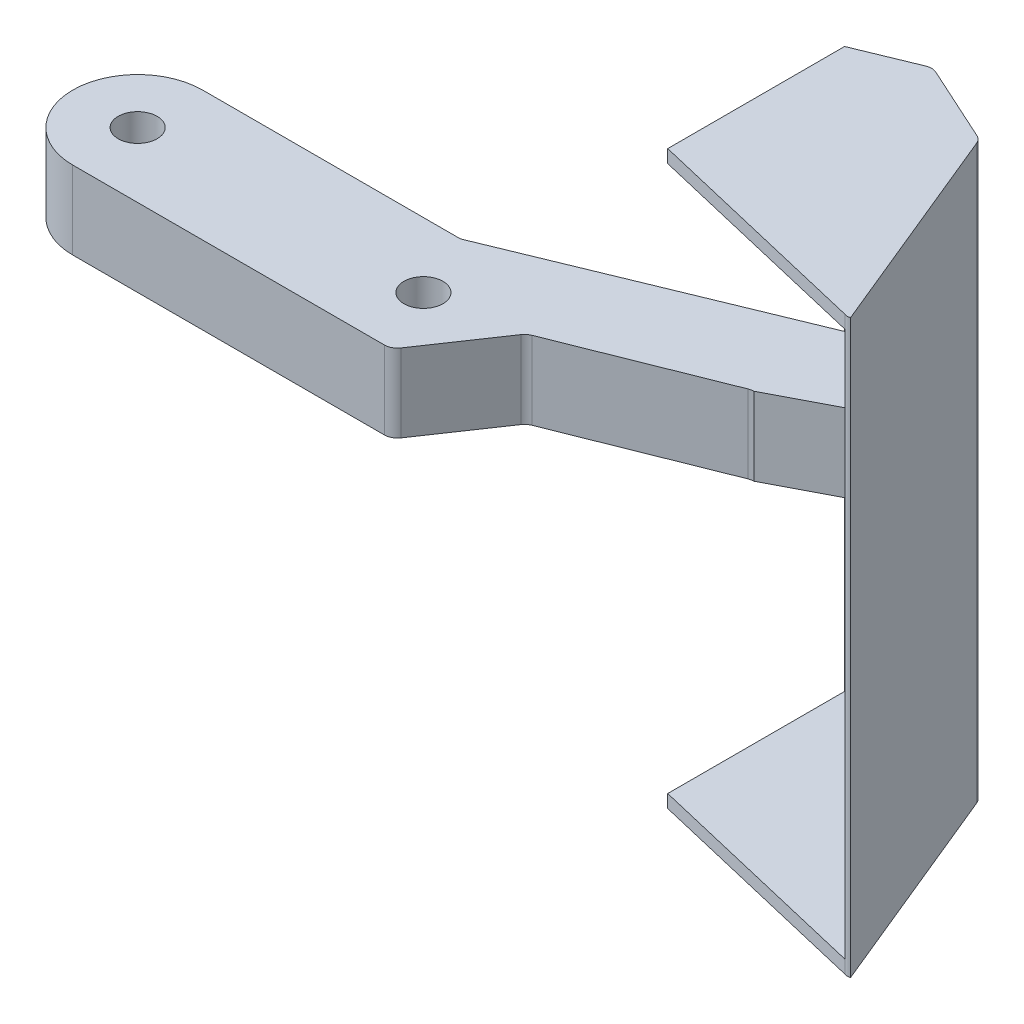
from build123d import *

# Parameters (mm, degrees)
SKETCH1_R                    = 1.5
BOSS_EXTRUDE1_DEPTH          = 6
SALIENTE_EXTRUIR7_DEPTH      = 19
SALIENTE_EXTRUIR7_DEPTH_BACK = 25
CORTAR_EXTRUIR2_DEPTH        = 25
SALIENTE_EXTRUIR8_DEPTH      = 1
SALIENTE_EXTRUIR10_DEPTH     = 1


with BuildPart() as part:
    # Sketch1 → Boss-Extrude1 (new body)
    with BuildSketch(Plane(origin=(0, 0, 0), x_dir=(1, 0, 0), z_dir=(0, 1, 0))):
        with BuildLine():
            Line((0, -5), (23.998875872, -5))
            ThreePointArc((23.998875872, -5), (24.467345461, -4.883479623), (24.826642543, -4.561072489))
            Line((24.826642543, -4.561072489), (28.564941326, 0.954149161))
            ThreePointArc((28.564941326, 0.954149161), (28.766036178, 1.172359953), (29.022312673, 1.321950886))
            Line((29.022312673, 1.321950886), (40.929553216, 6.070049343))
            ThreePointArc((40.929553216, 6.070049343), (41.304486381, 6.141164834), (41.678758689, 6.066649533))
            Line((41.678758689, 6.066649533), (47.144586244, 3.829406729))
            Line((47.144586244, 3.829406729), (48.06174016, 3.086958957))
            Line((48.06174016, 3.086958957), (48.804187932, 4.004112872))
            Line((48.804187932, 4.004112872), (49.721341848, 3.2616651))
            Line((49.721341848, 3.2616651), (50.46378962, 4.178819016))
            Line((50.46378962, 4.178819016), (51.380943536, 3.436371244))
            Line((51.380943536, 3.436371244), (52.123391308, 4.35352516))
            Line((52.123391308, 4.35352516), (53.040545224, 3.611077387))
            Line((53.040545224, 3.611077387), (53.782992996, 4.528231303))
            Line((53.782992996, 4.528231303), (54.700146912, 3.785783531))
            Line((54.700146912, 3.785783531), (55.442594685, 4.702937447))
            Line((55.442594685, 4.702937447), (52.341745918, 12.244834503))
            ThreePointArc((52.341745918, 12.244834503), (52.137055639, 12.558350103), (51.831402108, 12.774604725))
            Line((51.831402108, 12.774604725), (46.024183924, 15.419882568))
            ThreePointArc((46.024183924, 15.419882568), (45.628323444, 15.509674561), (45.229386093, 15.434727162))
            Line((45.229386093, 15.434727162), (20.032711481, 5.075121772))
            ThreePointArc((20.032711481, 5.075121772), (19.846254378, 5.018960187), (19.652448068, 5))
            Line((19.652448068, 5), (0, 5))
            ThreePointArc((0, 5), (-5, 0), (0, -5))
        make_face()
        with Locations(Location((0, 0, 0), (0, 0, 270))):
            Circle(SKETCH1_R, mode=Mode.SUBTRACT)
        with Locations(Location((22, 0, 0), (0, 0, 270))):
            Circle(SKETCH1_R, mode=Mode.SUBTRACT)
    extrude(amount=BOSS_EXTRUDE1_DEPTH)

    # Croquis4 → Saliente-Extruir7 (add, two sides: drawn at the far end of the back side and taken through both)
    with BuildSketch(Plane.XZ.offset(-SALIENTE_EXTRUIR7_DEPTH_BACK)):
        with BuildLine():
            Line((54.700146912, -3.785783531), (55.442594685, -4.702937447))
            Line((55.442594685, -4.702937447), (58.800233779, 3.463526096))
            Line((58.800233779, 3.463526096), (59.114761869, 4.228522601))
            ThreePointArc((59.114761869, 4.228522601), (58.907872463, 4.269394003), (58.700983057, 4.228522601))
            Line((58.700983057, 4.228522601), (53.767339251, -4.508894058))
            Line((53.767339251, -4.508894058), (53.782992996, -4.528231303))
            Line((53.782992996, -4.528231303), (54.700146912, -3.785783531))
        make_face()
        with BuildLine():
            Line((54.16164527, -7.818467854), (54.301219391, -7.478995106))
            Line((54.301219391, -7.478995106), (55.442594685, -4.702937447))
            Line((55.442594685, -4.702937447), (54.700146912, -3.785783531))
            Line((54.700146912, -3.785783531), (53.782992996, -4.528231303))
            Line((53.782992996, -4.528231303), (53.767339251, -4.508894058))
            Line((53.767339251, -4.508894058), (50.221708115, -10.788158993))
            Line((50.221708115, -10.788158993), (40.806466815, -13.616245196))
            Line((40.806466815, -13.616245196), (45.229386093, -15.434727162))
            ThreePointArc((45.229386093, -15.434727162), (45.628323444, -15.509674561), (46.024183924, -15.419882568))
            Line((46.024183924, -15.419882568), (51.831402108, -12.774604725))
            ThreePointArc((51.831402108, -12.774604725), (52.137055639, -12.558350103), (52.341745918, -12.244834503))
            Line((52.341745918, -12.244834503), (54.16164527, -7.818467854))
        make_face()
    extrude(amount=SALIENTE_EXTRUIR7_DEPTH + SALIENTE_EXTRUIR7_DEPTH_BACK)

    # Croquis5 → Cortar-Extruir2 (cut)
    with BuildSketch(Plane.XZ):
        Polygon((41.304486381, -6.141164834), (50.221708115, -10.788158993), (53.767339251, -4.508894058), (53.601046398, -4.303470665), (53.040545224, -3.611077387), (52.123391308, -4.35352516), (51.380943536, -3.436371244), (50.46378962, -4.178819016), (49.721341848, -3.2616651), (48.804187932, -4.004112872), (48.06174016, -3.086958957), (47.144586244, -3.829406729), align=None)
    extrude(amount=-CORTAR_EXTRUIR2_DEPTH, mode=Mode.SUBTRACT)

    # Croquis6 → Saliente-Extruir8 (add)
    with BuildSketch(Plane(origin=(0, -19, 0), x_dir=(-1, 0, 0), z_dir=(0, -1, 0))):
        Polygon((-40.806466815, 13.616245196), (-40.806466815, 0), (-58.700983057, -4.228522601), (-50.221708115, 10.788158993), align=None)
    extrude(amount=-SALIENTE_EXTRUIR8_DEPTH)

    # Croquis7 → Saliente-Extruir10 (add)
    with BuildSketch(Plane(origin=(0, 25, 0), x_dir=(1, 0, 0), z_dir=(0, 1, 0))):
        Polygon((40.806466815, 0), (40.806466815, 13.616245196), (50.221708115, 10.788158993), (58.700983057, -4.228522601), align=None)
    extrude(amount=-SALIENTE_EXTRUIR10_DEPTH)


solid = part.part
